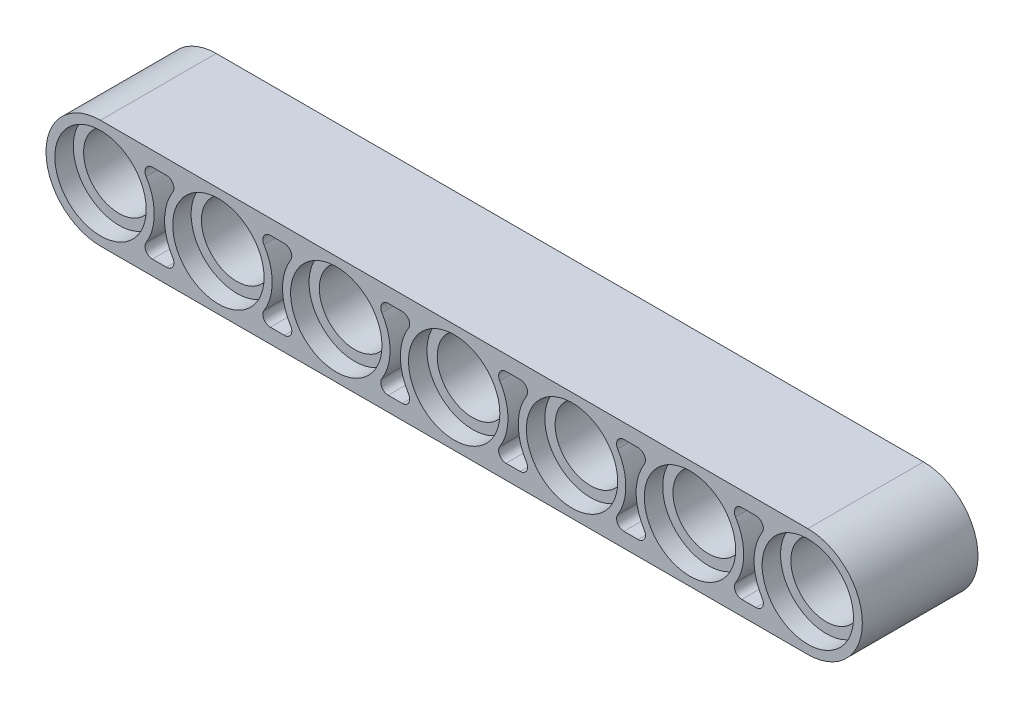
from build123d import *

# Parameters (mm, degrees)
SKETCH1_R            = 2.4
BEAM_DEPTH           = 3.925
SKETCH3_R            = 3.1
HOLE_SURROUND_DEPTH  = 1.25
CAVITY_CUT_DEPTH     = 3
FILLET2_R            = 0.5
FILLET2_OF_MIRROR2_R = 0.5


with BuildPart() as part:
    # Sketch1 → Beam (new, symmetric)
    with BuildSketch(Plane.XY):
        with BuildLine():
            Line((48, 3.7), (0, 3.7))
            ThreePointArc((0, 3.7), (-3.7, 0), (0, -3.7))
            Line((0, -3.7), (48, -3.7))
            ThreePointArc((48, -3.7), (51.7, 0), (48, 3.7))
        make_face()
        Circle(SKETCH1_R, mode=Mode.SUBTRACT)
        with Locations((8, 0)):
            Circle(SKETCH1_R, mode=Mode.SUBTRACT)
        with Locations((16, 0)):
            Circle(SKETCH1_R, mode=Mode.SUBTRACT)
        with Locations((24, 0)):
            Circle(SKETCH1_R, mode=Mode.SUBTRACT)
        with Locations((32, 0)):
            Circle(SKETCH1_R, mode=Mode.SUBTRACT)
        with Locations((40, 0)):
            Circle(SKETCH1_R, mode=Mode.SUBTRACT)
        with Locations((48, 0)):
            Circle(SKETCH1_R, mode=Mode.SUBTRACT)
    extrude(amount=BEAM_DEPTH, both=True)

    # Sketch3 → Hole Surround (cut)
    with BuildSketch(Plane.XY.offset(3.925)):
        with Locations((48, 0)):
            Circle(SKETCH3_R)
        with Locations((40, 0)):
            Circle(SKETCH3_R)
        with Locations((32, 0)):
            Circle(SKETCH3_R)
        with Locations((24, 0)):
            Circle(SKETCH3_R)
        with Locations((16, 0)):
            Circle(SKETCH3_R)
        with Locations((8, 0)):
            Circle(SKETCH3_R)
        Circle(SKETCH3_R)
    hole_surround = extrude(amount=-HOLE_SURROUND_DEPTH, mode=Mode.SUBTRACT)

    # Sketch4 → Cavity Cut (cut)
    with BuildSketch(Plane.XY.offset(3.925)):
        with BuildLine():
            ThreePointArc((2.456114818, 2.7), (3.65, 0), (2.456114818, -2.7))
            Line((2.456114818, -2.7), (5.543885182, -2.7))
            ThreePointArc((5.543885182, -2.7), (4.35, 0), (5.543885182, 2.7))
            Line((5.543885182, 2.7), (2.456114818, 2.7))
        make_face()
        with BuildLine():
            ThreePointArc((10.456114818, 2.7), (11.65, 0), (10.456114818, -2.7))
            Line((10.456114818, -2.7), (13.543885182, -2.7))
            ThreePointArc((13.543885182, -2.7), (12.35, 0), (13.543885182, 2.7))
            Line((13.543885182, 2.7), (10.456114818, 2.7))
        make_face()
        with BuildLine():
            ThreePointArc((18.456114818, 2.7), (19.65, 0), (18.456114818, -2.7))
            Line((18.456114818, -2.7), (21.543885182, -2.7))
            ThreePointArc((21.543885182, -2.7), (20.35, 0), (21.543885182, 2.7))
            Line((21.543885182, 2.7), (18.456114818, 2.7))
        make_face()
        with BuildLine():
            ThreePointArc((26.456114818, 2.7), (27.65, 0), (26.456114818, -2.7))
            Line((26.456114818, -2.7), (29.543885182, -2.7))
            ThreePointArc((29.543885182, -2.7), (28.35, 0), (29.543885182, 2.7))
            Line((29.543885182, 2.7), (26.456114818, 2.7))
        make_face()
        with BuildLine():
            ThreePointArc((34.456114818, 2.7), (35.65, 0), (34.456114818, -2.7))
            Line((34.456114818, -2.7), (37.543885182, -2.7))
            ThreePointArc((37.543885182, -2.7), (36.35, 0), (37.543885182, 2.7))
            Line((37.543885182, 2.7), (34.456114818, 2.7))
        make_face()
        with BuildLine():
            ThreePointArc((42.456114818, 2.7), (43.65, 0), (42.456114818, -2.7))
            Line((42.456114818, -2.7), (45.543885182, -2.7))
            ThreePointArc((45.543885182, -2.7), (44.35, 0), (45.543885182, 2.7))
            Line((45.543885182, 2.7), (42.456114818, 2.7))
        make_face()
    cavity_cut = extrude(amount=-CAVITY_CUT_DEPTH, mode=Mode.SUBTRACT)

    # Fillet2
    fillet2_edges = [part.edges().sort_by_distance(p)[0] for p in [
        (45.543885182, 2.7, 2.425),
        (42.456114818, 2.7, 2.425),
        (42.456114818, -2.7, 2.425),
        (45.543885182, -2.7, 2.425),
        (37.543885182, 2.7, 2.425),
        (34.456114818, 2.7, 2.425),
        (34.456114818, -2.7, 2.425),
        (37.543885182, -2.7, 2.425),
        (29.543885182, 2.7, 2.425),
        (26.456114818, 2.7, 2.425),
        (26.456114818, -2.7, 2.425),
        (29.543885182, -2.7, 2.425),
        (21.543885182, 2.7, 2.425),
        (18.456114818, 2.7, 2.425),
        (18.456114818, -2.7, 2.425),
        (21.543885182, -2.7, 2.425),
        (13.543885182, -2.7, 2.425),
        (10.456114818, -2.7, 2.425),
        (13.543885182, 2.7, 2.425),
        (10.456114818, 2.7, 2.425),
        (5.543885182, -2.7, 2.425),
        (5.543885182, 2.7, 2.425),
        (2.456114818, -2.7, 2.425),
        (2.456114818, 2.7, 2.425),
    ]]
    fillet(fillet2_edges, radius=FILLET2_R)

    # Mirror2: Hole Surround, Cavity Cut across plane
    add(hole_surround.mirror(Plane.XY), mode=Mode.SUBTRACT)
    add(cavity_cut.mirror(Plane.XY), mode=Mode.SUBTRACT)

    # Fillet2 of Mirror2
    fillet2_of_mirror2_edges = [part.edges().sort_by_distance(p)[0] for p in [
        (45.543885182, 2.7, -2.425),
        (42.456114818, 2.7, -2.425),
        (42.456114818, -2.7, -2.425),
        (45.543885182, -2.7, -2.425),
        (37.543885182, 2.7, -2.425),
        (34.456114818, 2.7, -2.425),
        (34.456114818, -2.7, -2.425),
        (37.543885182, -2.7, -2.425),
        (29.543885182, 2.7, -2.425),
        (26.456114818, 2.7, -2.425),
        (26.456114818, -2.7, -2.425),
        (29.543885182, -2.7, -2.425),
        (21.543885182, 2.7, -2.425),
        (18.456114818, 2.7, -2.425),
        (18.456114818, -2.7, -2.425),
        (21.543885182, -2.7, -2.425),
        (13.543885182, -2.7, -2.425),
        (10.456114818, -2.7, -2.425),
        (13.543885182, 2.7, -2.425),
        (10.456114818, 2.7, -2.425),
        (5.543885182, -2.7, -2.425),
        (5.543885182, 2.7, -2.425),
        (2.456114818, -2.7, -2.425),
        (2.456114818, 2.7, -2.425),
    ]]
    fillet(fillet2_of_mirror2_edges, radius=FILLET2_OF_MIRROR2_R)


solid = part.part
